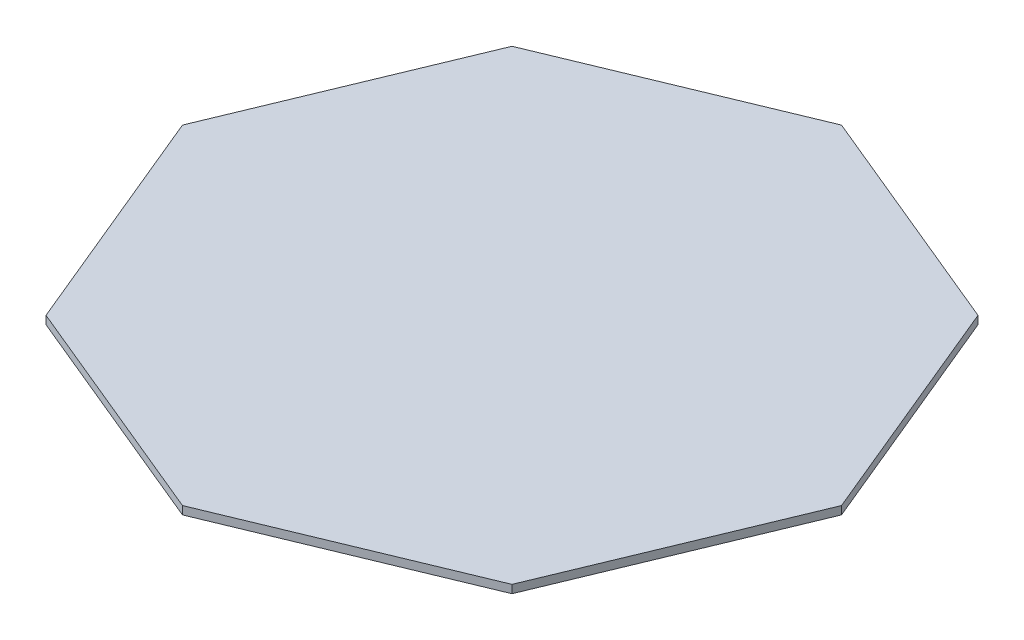
from build123d import *

# Parameters (mm, degrees)
BOSS_EXTRUDE1_DEPTH = 2


with BuildPart() as part:
    # Sketch1 → Boss-Extrude1 (new body)
    with BuildSketch(Plane(origin=(0, 0, 0), x_dir=(1, 0, 0), z_dir=(0, 1, 0))):
        Polygon((0, 81.179415022), (-57.402514855, 57.402514855), (-81.179415022, 0), (-57.402514855, -57.402514855), (0, -81.179415022), (57.402514855, -57.402514855), (81.179415022, 0), (57.402514855, 57.402514855), align=None)
    extrude(amount=BOSS_EXTRUDE1_DEPTH)


solid = part.part
